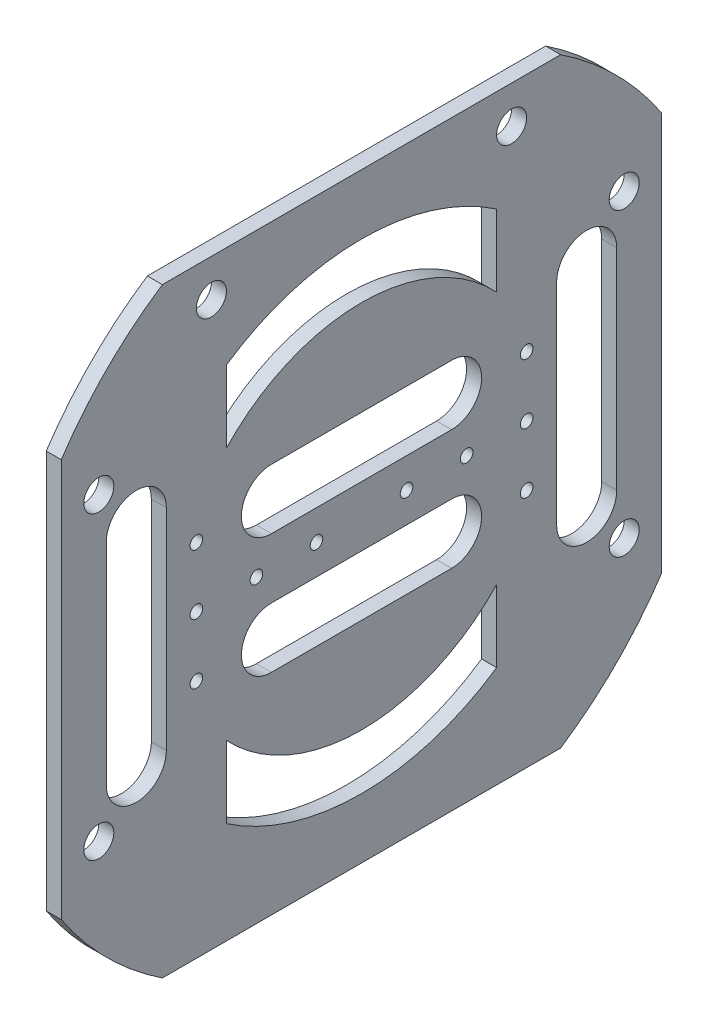
from build123d import *

# Parameters (mm, degrees)
SKETCH_1_W          = 200
SKETCH_1_H          = 200
SKETCH_1_R          = 5
EXTRUDE_1_DEPTH     = 5
SKETCH_3_R          = 2.1
CUT_EXTRUDE_2_DEPTH = 142.509716981


with BuildPart() as part:
    # 草图1 → 凸台-拉伸1 (new body)
    with BuildSketch(Plane(origin=(0, 0, 0), x_dir=(0, 0, -1), z_dir=(1, 0, 0))):
        Rectangle(SKETCH_1_W, SKETCH_1_H)
        with Locations((-50, 87.5)):
            Circle(SKETCH_1_R, mode=Mode.SUBTRACT)
        with Locations((50, 87.5)):
            Circle(SKETCH_1_R, mode=Mode.SUBTRACT)
        with Locations((-87.5, 50)):
            Circle(SKETCH_1_R, mode=Mode.SUBTRACT)
        with Locations((-87.5, -50)):
            Circle(SKETCH_1_R, mode=Mode.SUBTRACT)
        with Locations(Location((87.5, -50, 0), (0, 0, 180))):
            Circle(SKETCH_1_R, mode=Mode.SUBTRACT)
        with Locations(Location((87.5, 50, 0), (0, 0, 180))):
            Circle(SKETCH_1_R, mode=Mode.SUBTRACT)
    extrude(amount=EXTRUDE_1_DEPTH)

    # 草图3 → 切除-拉伸2 (cut, through all)
    with BuildSketch(Plane(origin=(5, 0, 0), x_dir=(0, 0, -1), z_dir=(1, 0, 0))):
        with Locations((-55, 20)):
            Circle(SKETCH_3_R)
        with Locations((-55, 0)):
            Circle(SKETCH_3_R)
        with Locations((-55, -20)):
            Circle(SKETCH_3_R)
        with Locations((55, 0)):
            Circle(SKETCH_3_R)
        with Locations((55, 20)):
            Circle(SKETCH_3_R)
        with Locations((55, -20)):
            Circle(SKETCH_3_R)
        with Locations((-35, 0)):
            Circle(SKETCH_3_R)
        with Locations((-15, 0)):
            Circle(SKETCH_3_R)
        with Locations((35, 0)):
            Circle(SKETCH_3_R)
        with Locations((15, 0)):
            Circle(SKETCH_3_R)
        with BuildLine():
            Line((-45, 66.143782777), (-45, 42.143782777))
            ThreePointArc((-45, 42.143782777), (0, 61.653048803), (45, 42.143782777))
            Line((45, 42.143782777), (45, 66.143782777))
            ThreePointArc((45, 66.143782777), (0, 80), (-45, 66.143782777))
        make_face()
        with BuildLine():
            Line((-45, -66.143782777), (-45, -42.143782777))
            ThreePointArc((-45, -42.143782777), (0, -61.653048803), (45, -42.143782777))
            Line((45, -42.143782777), (45, -66.143782777))
            ThreePointArc((45, -66.143782777), (0, -80), (-45, -66.143782777))
        make_face()
        with BuildLine():
            Line((-100, -66.332495807), (-100, -100))
            Line((-100, -100), (-66.332495807, -100))
            ThreePointArc((-66.332495807, -100), (-84.852813742, -84.852813742), (-100, -66.332495807))
        make_face()
        with BuildLine():
            Line((66.332495807, -100), (100, -100))
            Line((100, -100), (100, -66.332495807))
            ThreePointArc((100, -66.332495807), (84.852813742, -84.852813742), (66.332495807, -100))
        make_face()
        with BuildLine():
            Line((66.332495807, 100), (100, 100))
            Line((100, 100), (100, 66.332495807))
            ThreePointArc((100, 66.332495807), (84.852813742, 84.852813742), (66.332495807, 100))
        make_face()
        with BuildLine():
            Line((-100, 66.332495807), (-100, 100))
            Line((-100, 100), (-66.332495807, 100))
            ThreePointArc((-66.332495807, 100), (-84.852813742, 84.852813742), (-100, 66.332495807))
        make_face()
        with BuildLine():
            Line((-65, 35), (-65, -35))
            ThreePointArc((-65, -35), (-75, -45), (-85, -35))
            Line((-85, -35), (-85, 35))
            ThreePointArc((-85, 35), (-75, 45), (-65, 35))
        make_face()
        with BuildLine():
            Line((65, 35), (65, -35))
            ThreePointArc((65, -35), (75, -45), (85, -35))
            Line((85, -35), (85, 35))
            ThreePointArc((85, 35), (75, 45), (65, 35))
        make_face()
        with BuildLine():
            Line((-30, 30), (30, 30))
            ThreePointArc((30, 30), (40, 20), (30, 10))
            Line((30, 10), (-30, 10))
            ThreePointArc((-30, 10), (-40, 20), (-30, 30))
        make_face()
        with BuildLine():
            Line((-30, -30), (30, -30))
            ThreePointArc((30, -30), (40, -20), (30, -10))
            Line((30, -10), (-30, -10))
            ThreePointArc((-30, -10), (-40, -20), (-30, -30))
        make_face()
    extrude(amount=-CUT_EXTRUDE_2_DEPTH, mode=Mode.SUBTRACT)


solid = part.part
